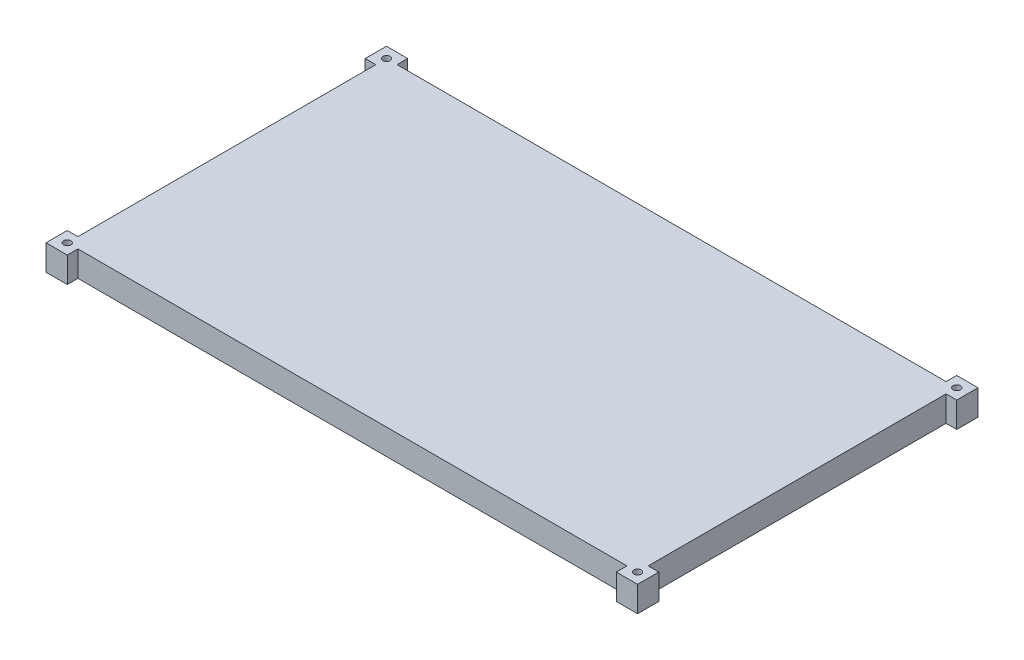
from build123d import *

# Parameters (mm, degrees)
SKETCH3_W           = 170.18
SKETCH3_H           = 95.25
BOSS_EXTRUDE1_DEPTH = 7.62
SKETCH4_W           = 6.35
SKETCH4_H           = 6.35
BOSS_EXTRUDE3_DEPTH = 7.62
SKETCH6_R           = 1.0922
CUT_EXTRUDE1_DEPTH  = 10.16


with BuildPart() as part:
    # Sketch3 → Boss-Extrude1 (new body)
    with BuildSketch(Plane(origin=(0, 0, 0), x_dir=(1, 0, 0), z_dir=(0, 1, 0))):
        Rectangle(SKETCH3_W, SKETCH3_H)
    extrude(amount=BOSS_EXTRUDE1_DEPTH)

    # Sketch4 → Boss-Extrude3 (add)
    with BuildSketch(Plane(origin=(0, 7.62, 0), x_dir=(1, 0, 0), z_dir=(0, 1, 0))):
        with Locations((-85.09, 47.625)):
            Rectangle(SKETCH4_W, SKETCH4_H)
        with Locations((-85.09, -47.625)):
            Rectangle(SKETCH4_W, SKETCH4_H)
        with Locations((85.09, 47.625)):
            Rectangle(SKETCH4_W, SKETCH4_H)
        with Locations((85.09, -47.625)):
            Rectangle(SKETCH4_W, SKETCH4_H)
    extrude(amount=-BOSS_EXTRUDE3_DEPTH)

    # Sketch6 → Cut-Extrude1 (cut)
    with BuildSketch(Plane(origin=(0, 7.62, 0), x_dir=(1, 0, 0), z_dir=(0, 1, 0))):
        with Locations(Location((-85.09, 47.625, 0), (0, 0, 270))):
            Circle(SKETCH6_R)
        with Locations(Location((-85.09, -47.625, 0), (0, 0, 270))):
            Circle(SKETCH6_R)
        with Locations(Location((85.09, -47.625, 0), (0, 0, 270))):
            Circle(SKETCH6_R)
        with Locations(Location((85.09, 47.625, 0), (0, 0, 270))):
            Circle(SKETCH6_R)
    extrude(amount=-CUT_EXTRUDE1_DEPTH, mode=Mode.SUBTRACT)


solid = part.part
